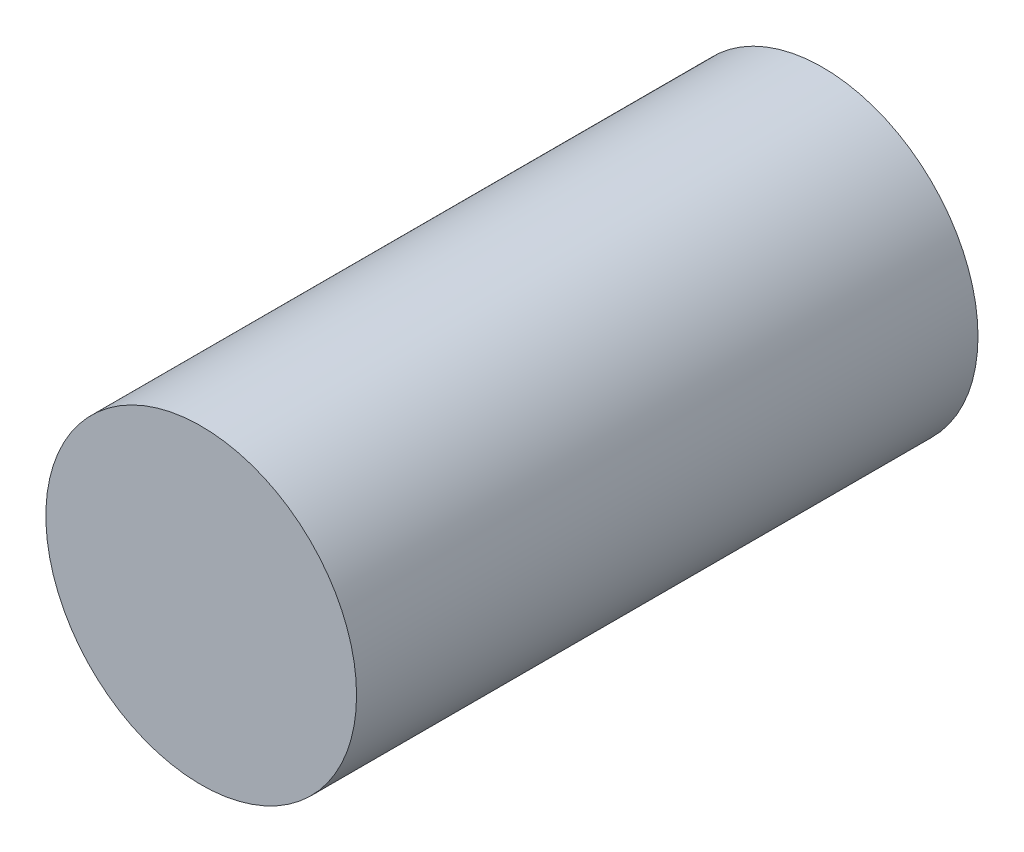
from build123d import *

# Parameters (mm, degrees)
SKETCH1_R           = 17.5
BOSS_EXTRUDE1_DEPTH = 70


with BuildPart() as part:
    # Sketch1 → Boss-Extrude1 (new body)
    with BuildSketch(Plane.XY):
        Circle(SKETCH1_R)
    extrude(amount=BOSS_EXTRUDE1_DEPTH)


solid = part.part
